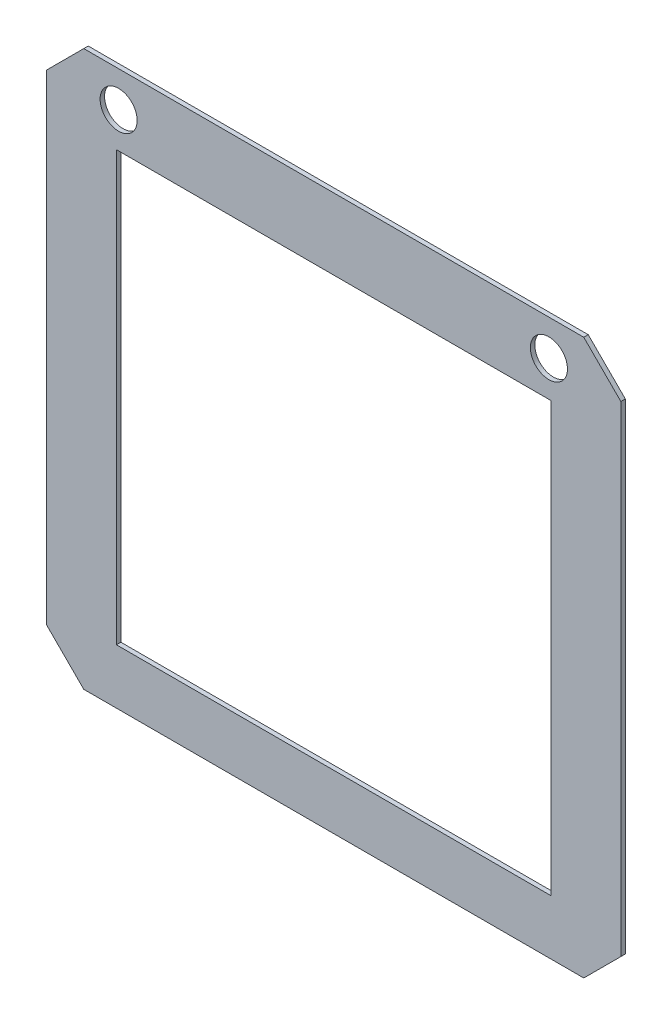
from build123d import *

# Parameters (mm, degrees)
ESQUISSE1_W             = 387
ESQUISSE1_H             = 374
ESQUISSE1_W_2           = 293
ESQUISSE1_H_2           = 289
BOSS_EXTRU_1_DEPTH      = 3
CHANFREIN1_SIZE         = 25
ESQUISSE2_R             = 12.5
ENL_V_MAT_EXTRU_1_DEPTH = 3


with BuildPart() as part:
    # Esquisse1 → Boss.-Extru.1 (new body)
    with BuildSketch(Plane.XY):
        Rectangle(ESQUISSE1_W, ESQUISSE1_H)
        with Locations((0, -5.5)):
            Rectangle(ESQUISSE1_W_2, ESQUISSE1_H_2, mode=Mode.SUBTRACT)
    extrude(amount=BOSS_EXTRU_1_DEPTH)

    # Chanfrein1
    chanfrein1_edges = [part.edges().sort_by_distance(p)[0] for p in [
        (193.5, -187, 1.5),
        (-193.5, -187, 1.5),
        (-193.5, 187, 1.5),
        (193.5, 187, 1.5),
    ]]
    chamfer(chanfrein1_edges, length=CHANFREIN1_SIZE)

    # Esquisse2 → Enlèv. mat.-Extru.1 (cut)
    with BuildSketch(Plane.XY.offset(3)):
        with Locations((145, 163)):
            Circle(ESQUISSE2_R)
        with Locations((-145, 163)):
            Circle(ESQUISSE2_R)
    extrude(amount=-ENL_V_MAT_EXTRU_1_DEPTH, mode=Mode.SUBTRACT)


solid = part.part
